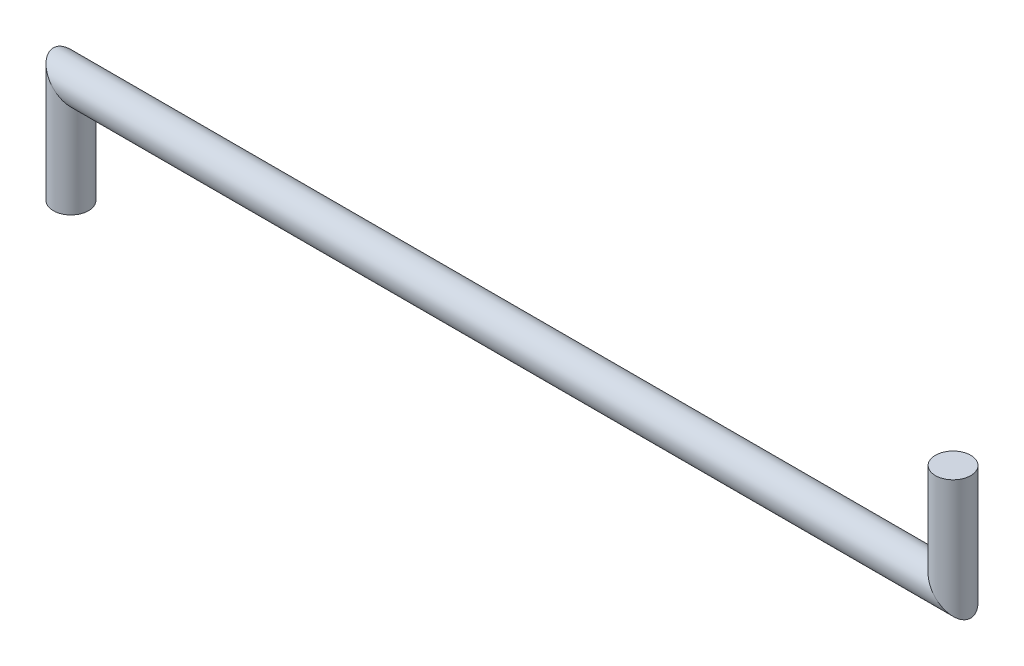
from build123d import *

# Parameters (mm, degrees)
CROQUIS2_R = 0.5


with BuildPart() as part:
    # Barrer2: sweep along a path in Croquis1
    with BuildLine(Plane.XY) as barrer2_path:
        Line((-62.081784827, 1.901408451), (-62.081784827, 4.901408451))
        Line((-62.081784827, 4.901408451), (-37.081784827, 4.901408451))
        Line((-37.081784827, 4.901408451), (-37.081784827, 7.901408451))
    # Croquis2 → Barrer2 (sweep)
    with BuildSketch(Plane(origin=(0, 7.901408451, 0), x_dir=(1, 0, 0), z_dir=(0, 1, 0))):
        with Locations((-37.081784827, 0)):
            Circle(CROQUIS2_R)
    sweep(path=barrer2_path.line, transition=Transition.RIGHT)


solid = part.part
